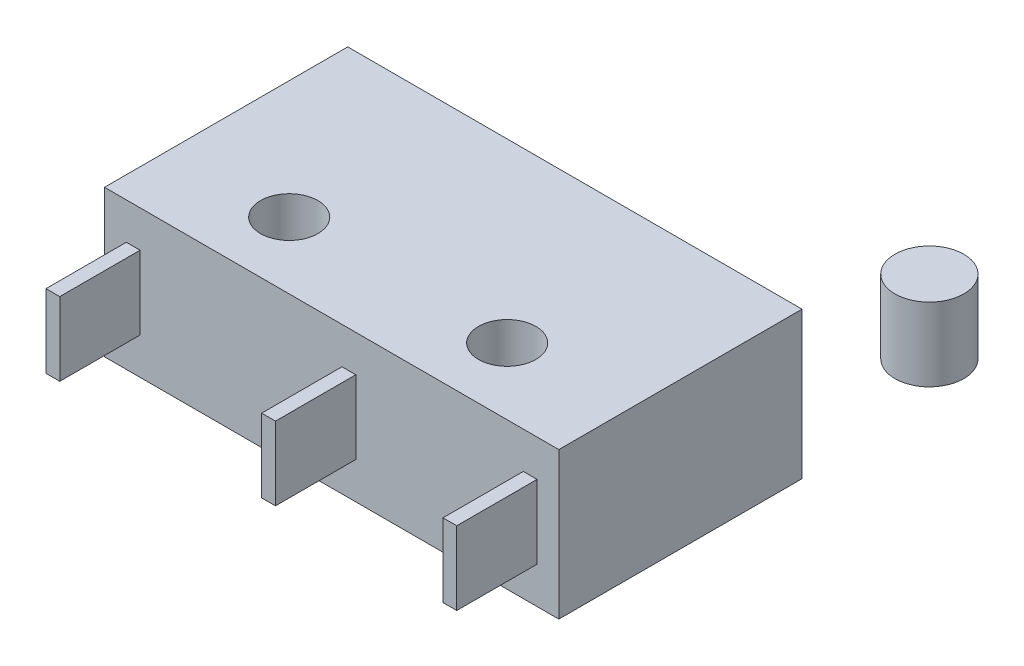
from build123d import *

# Parameters (mm, degrees)
BOSS_EXTRUDE1_DEPTH = 6.4
BOSS_EXTRUDE2_START = -1.6
SKETCH3_W           = 0.6
SKETCH3_H           = 3.5
SKETCH3_W_2         = 0.601181881
BOSS_EXTRUDE2_DEPTH = 3.2
BOSS_EXTRUDE4_START = -1.6
SKETCH4_R           = 1.5
SKETCH4_W           = 2
SKETCH4_H           = 1.3
BOSS_EXTRUDE4_DEPTH = 3.2


with BuildPart() as part:
    # Sketch1 → Boss-Extrude1 (new body)
    with BuildSketch(Plane(origin=(0, 0, 0), x_dir=(1, 0, 0), z_dir=(0, 1, 0))):
        with BuildLine():
            Line((33.135731415, 9.563994519), (29.235731415, 9.563994519))
            ThreePointArc((29.235731415, 9.563994519), (27.985731415, 8.313994519), (26.735731415, 9.563994519))
            Line((26.735731415, 9.563994519), (19.735731415, 9.563994519))
            ThreePointArc((19.735731415, 9.563994519), (18.485731415, 8.313994519), (17.235731415, 9.563994519))
            Line((17.235731415, 9.563994519), (13.335731415, 9.563994519))
            Line((13.335731415, 9.563994519), (13.335731415, 6.663994519))
            Line((13.335731415, 6.663994519), (33.135731415, 6.663994519))
            Line((33.135731415, 6.663994519), (33.135731415, 9.563994519))
        make_face()
        with BuildLine():
            ThreePointArc((26.735731415, 9.563994519), (27.985731415, 10.813994519), (29.235731415, 9.563994519))
            Line((29.235731415, 9.563994519), (33.135731415, 9.563994519))
            Line((33.135731415, 9.563994519), (33.135731415, 17.263994519))
            Line((33.135731415, 17.263994519), (21.485731415, 17.263994519))
            Line((21.485731415, 17.263994519), (19.485731415, 17.263994519))
            Line((19.485731415, 17.263994519), (13.335731415, 17.263994519))
            Line((13.335731415, 17.263994519), (13.335731415, 9.563994519))
            Line((13.335731415, 9.563994519), (17.235731415, 9.563994519))
            ThreePointArc((17.235731415, 9.563994519), (18.485731415, 10.813994519), (19.735731415, 9.563994519))
            Line((19.735731415, 9.563994519), (26.735731415, 9.563994519))
        make_face()
    extrude(amount=BOSS_EXTRUDE1_DEPTH)

    # Sketch3 → Boss-Extrude2 (add)
    with BuildSketch(Plane(origin=(0, 6.4, 0), x_dir=(1, 0, 0), z_dir=(0, 1, 0)).offset(BOSS_EXTRUDE2_START)):
        with Locations((14.585731415, 4.913994519)):
            Rectangle(SKETCH3_W, SKETCH3_H)
        with Locations((23.986322356, 4.913994519)):
            Rectangle(SKETCH3_W_2, SKETCH3_H)
        with Locations((31.886913296, 4.913994519)):
            Rectangle(SKETCH3_W, SKETCH3_H)
    extrude(amount=-BOSS_EXTRUDE2_DEPTH)

    # Sketch4 → Boss-Extrude4 (add)
    with BuildSketch(Plane.XZ.offset(BOSS_EXTRUDE4_START)):
        with Locations(Location((32.985731415, -22.963994519, 0), (0, 0, 270))):
            Circle(SKETCH4_R)
        with Locations((20.485731415, -17.913994519)):
            Rectangle(SKETCH4_W, SKETCH4_H)
    extrude(amount=-BOSS_EXTRUDE4_DEPTH)


with BuildPart() as boss_extrude4_piece_1:
    # of the separate pieces the step leaves, piece 1, a body of its own (boss_extrude4_pieces)
    add(part.part.solids().sort_by_distance((29.235731415, 6.4, -9.563994519))[0])


with BuildPart() as boss_extrude4_piece_2:
    # of the separate pieces the step leaves, piece 2, a body of its own (boss_extrude4_pieces)
    add(part.part.solids().sort_by_distance((32.985731415, 1.6, -24.463994519))[0])


solid = Compound([boss_extrude4_piece_1.part, boss_extrude4_piece_2.part])
